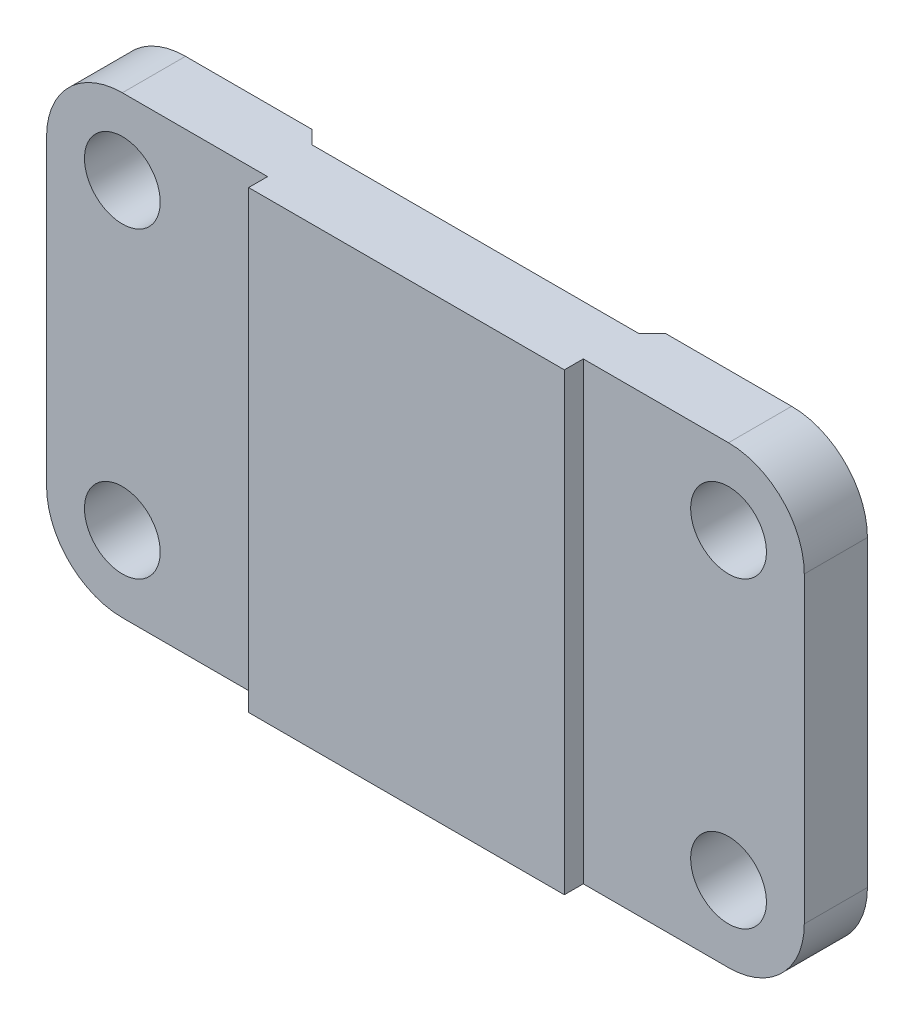
from build123d import *

# Parameters (mm, degrees)
BOSS_EXTRUDE1_DEPTH = 10
SKETCH2_R           = 6
CUT_EXTRUDE1_DEPTH  = 71.682388188
CUT_EXTRUDE2_DEPTH  = 95.254973344
SKETCH4_W           = 50
SKETCH4_H           = 72
BOSS_EXTRUDE2_DEPTH = 3


with BuildPart() as part:
    # Sketch1 → Boss-Extrude1 (new body)
    with BuildSketch(Plane.XY):
        with BuildLine():
            Line((-48, 36), (48, 36))
            ThreePointArc((48, 36), (56.485281374, 32.485281374), (60, 24))
            Line((60, 24), (60, -24))
            ThreePointArc((60, -24), (56.485281374, -32.485281374), (48, -36))
            Line((48, -36), (-48, -36))
            ThreePointArc((-48, -36), (-56.485281374, -32.485281374), (-60, -24))
            Line((-60, -24), (-60, 24))
            ThreePointArc((-60, 24), (-56.485281374, 32.485281374), (-48, 36))
        make_face()
    extrude(amount=BOSS_EXTRUDE1_DEPTH)

    # Sketch2 → Cut-Extrude1 (cut, through all)
    with BuildSketch(Plane.XY.offset(10)):
        with Locations((-48, 24)):
            Circle(SKETCH2_R)
        with Locations((-48, -24)):
            Circle(SKETCH2_R)
        with Locations(Location((48, -24, 0), (0, 0, 180))):
            Circle(SKETCH2_R)
        with Locations(Location((48, 24, 0), (0, 0, 180))):
            Circle(SKETCH2_R)
    extrude(amount=-CUT_EXTRUDE1_DEPTH, mode=Mode.SUBTRACT)

    # Sketch3 → Cut-Extrude2 (cut, through all)
    with BuildSketch(Plane.XZ.offset(36)):
        Polygon((-28, 0), (28, 0), (25.878679656, 2.121320344), (-25.878679656, 2.121320344), align=None)
    extrude(amount=-CUT_EXTRUDE2_DEPTH, mode=Mode.SUBTRACT)

    # Sketch4 → Boss-Extrude2 (add)
    with BuildSketch(Plane.XY.offset(10)):
        Rectangle(SKETCH4_W, SKETCH4_H)
    extrude(amount=BOSS_EXTRUDE2_DEPTH)


solid = part.part
